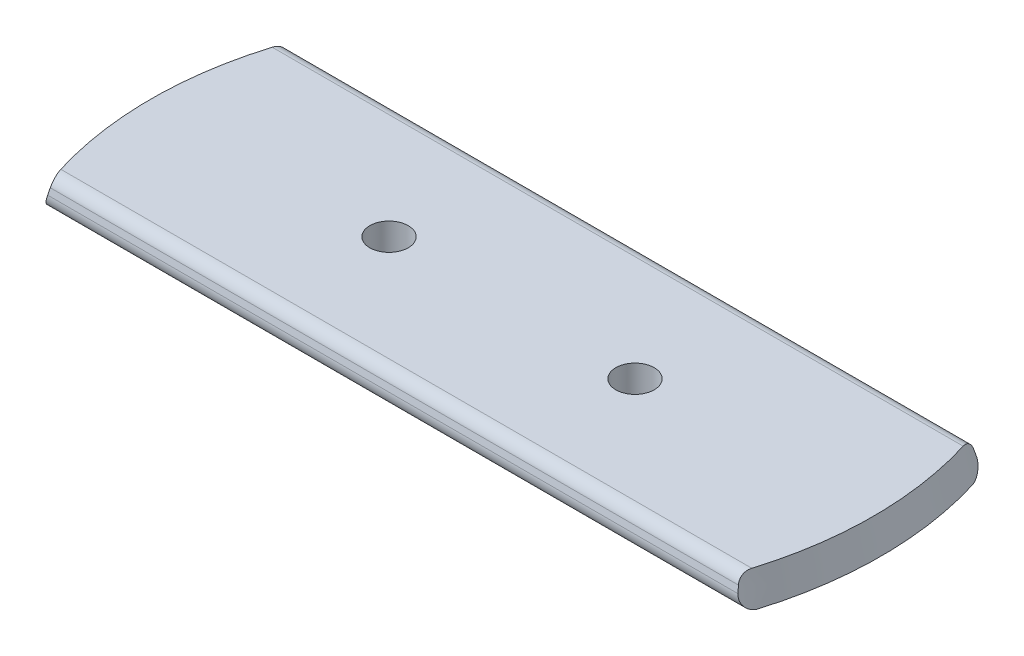
from build123d import *

# Parameters (mm, degrees)
BOSS_EXTRUDE1_DEPTH                 = 0.635
BOSS_EXTRUDE1_TAPER                 = 14
F_1_32_0_03125_DIAMETER_HOLE1_D     = 0.79375
F_1_32_0_03125_DIAMETER_HOLE1_DEPTH = 12.7
F_1_32_0_03125_DIAMETER_HOLE1_TIP   = 0.238466558
FILLET1_R                           = 0.254


with BuildPart() as part:
    # Sketch1 → Boss-Extrude1 (new body)
    with BuildSketch(Plane(origin=(0, 0, 0), x_dir=(1, 0, 0), z_dir=(0, 1, 0))):
        with BuildLine():
            Line((-7.184204897, -2.54), (7.184204897, -2.54))
            ThreePointArc((7.184204897, -2.54), (7.62, 0), (7.184204897, 2.54))
            Line((7.184204897, 2.54), (-7.184204897, 2.54))
            ThreePointArc((-7.184204897, 2.54), (-7.62, 0), (-7.184204897, -2.54))
        make_face()
    extrude(amount=BOSS_EXTRUDE1_DEPTH, taper=BOSS_EXTRUDE1_TAPER)

    # 1/32 (0.03125) Diameter Hole1
    with Locations(Plane(origin=(0, 0, 0), x_dir=(-1, 0, 0), z_dir=(0, -1, 0))):
        with Locations((2.54, 0), (-2.54, 0)):
            Hole(F_1_32_0_03125_DIAMETER_HOLE1_D / 2, depth=F_1_32_0_03125_DIAMETER_HOLE1_DEPTH)
            with Locations((0, 0, -(F_1_32_0_03125_DIAMETER_HOLE1_DEPTH + F_1_32_0_03125_DIAMETER_HOLE1_TIP / 2))):  # 118° drill point
                Cone(0, F_1_32_0_03125_DIAMETER_HOLE1_D / 2, F_1_32_0_03125_DIAMETER_HOLE1_TIP, mode=Mode.SUBTRACT)

    # Fillet1
    fillet1_edges = [part.edges().sort_by_distance(p)[0] for p in [
        (0, 0, -2.54),
        (0, 0.635, -2.381676718),
        (0, 0, 2.54),
        (0, 0.635, 2.381676718),
    ]]
    fillet(fillet1_edges, radius=FILLET1_R)


solid = part.part
